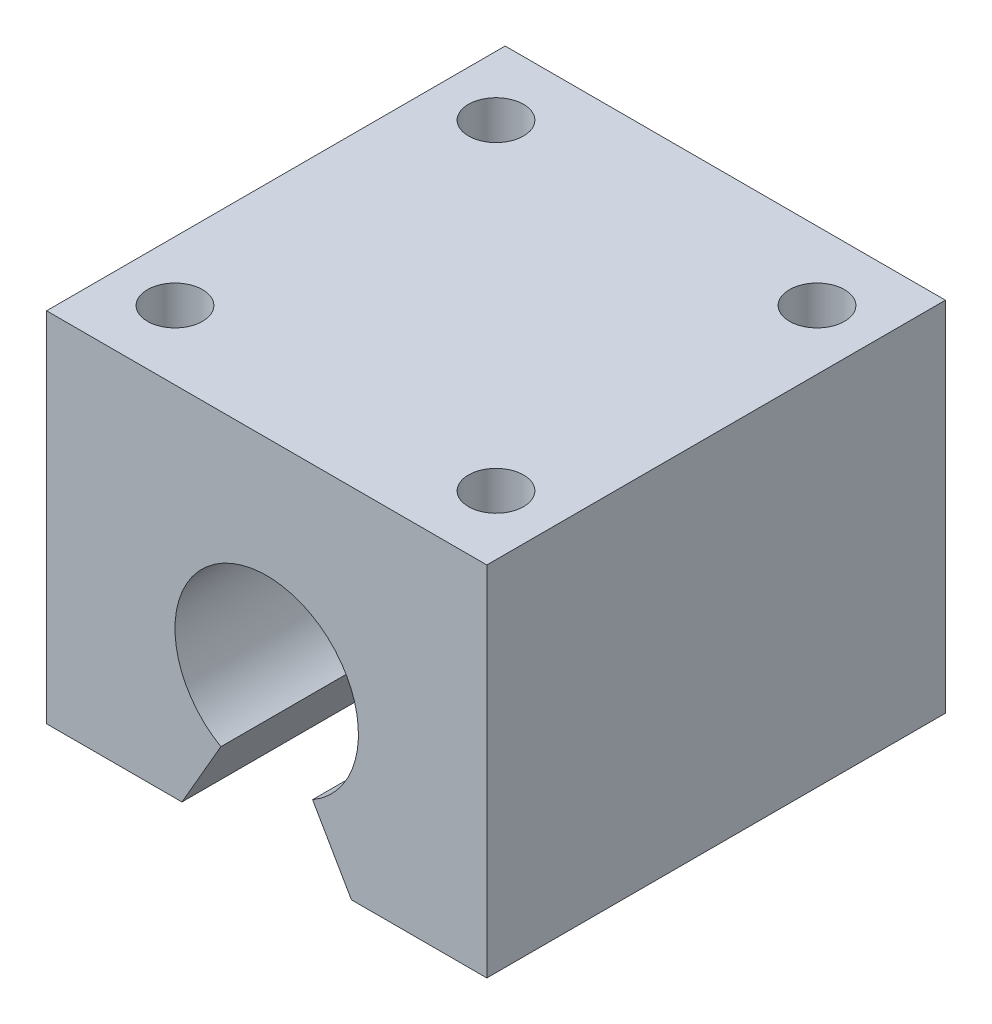
from build123d import *

# Parameters (mm, degrees)
BOSS_EXTRUDE1_DEPTH = 25
SKETCH2_R           = 3
CUT_EXTRUDE1_DEPTH  = 11


with BuildPart() as part:
    # Sketch1 → Boss-Extrude1 (new, symmetric)
    with BuildSketch(Plane.XY):
        with BuildLine():
            Line((-24, 23), (24, 23))
            Line((24, 23), (24, -16))
            Line((24, -16), (9.237604307, -16))
            Line((9.237604307, -16), (5, -8.660254038))
            ThreePointArc((5, -8.660254038), (0, 10), (-5, -8.660254038))
            Line((-5, -8.660254038), (-9.237604307, -16))
            Line((-9.237604307, -16), (-24, -16))
            Line((-24, -16), (-24, 23))
        make_face()
    extrude(amount=BOSS_EXTRUDE1_DEPTH, both=True)

    # Sketch2 → Cut-Extrude1 (cut)
    with BuildSketch(Plane(origin=(0, 23, 0), x_dir=(1, 0, 0), z_dir=(0, 1, 0))):
        with Locations(Location((-17.5, 17.5, 0), (0, 0, 270))):
            Circle(SKETCH2_R)
        with Locations(Location((17.5, 17.5, 0), (0, 0, 270))):
            Circle(SKETCH2_R)
        with Locations(Location((17.5, -17.5, 0), (0, 0, 270))):
            Circle(SKETCH2_R)
        with Locations(Location((-17.5, -17.5, 0), (0, 0, 270))):
            Circle(SKETCH2_R)
    extrude(amount=-CUT_EXTRUDE1_DEPTH, mode=Mode.SUBTRACT)


solid = part.part
